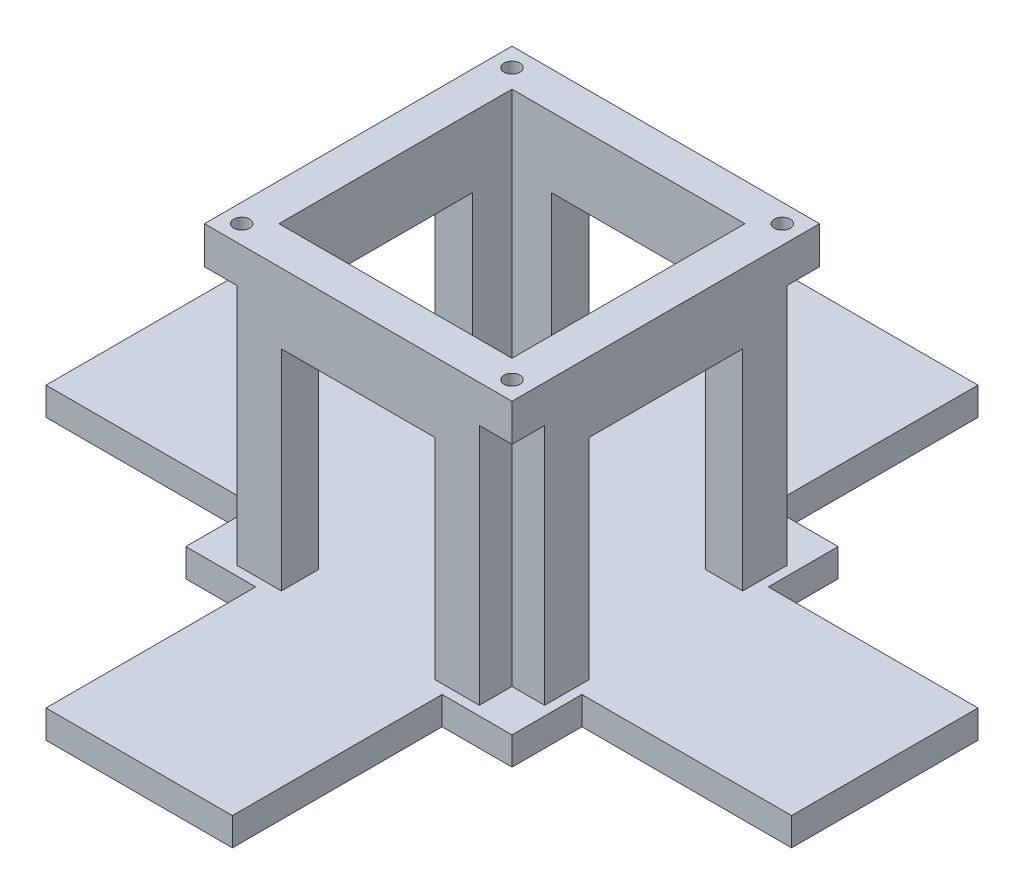
from build123d import *

# Parameters (mm, degrees)
BOSS_EXTRUDE1_DEPTH = 6
SKETCH2_W           = 66
SKETCH2_H           = 66
SKETCH2_R           = 1.705
SKETCH2_W_2         = 50
SKETCH2_H_2         = 50
BOSS_EXTRUDE2_DEPTH = 60
SKETCH4_W           = 7
SKETCH4_H           = 7
CUT_EXTRUDE2_DEPTH  = 52
SKETCH5_W           = 33
SKETCH5_H           = 8
SKETCH5_W_2         = 8
SKETCH5_H_2         = 33
CUT_EXTRUDE3_DEPTH  = 45


with BuildPart() as part:
    # Sketch1 → Boss-Extrude1 (new body)
    with BuildSketch(Plane(origin=(0, 0, 0), x_dir=(1, 0, 0), z_dir=(0, 1, 0))):
        Polygon((-20, 80), (20, 80), (20, 35), (35, 35), (35, 20), (80, 20), (80, -20), (35, -20), (35, -35), (20, -35), (20, -80), (-20, -80), (-20, -35), (-35, -35), (-35, -20), (-80, -20), (-80, 20), (-35, 20), (-35, 35), (-20, 35), align=None)
    extrude(amount=-BOSS_EXTRUDE1_DEPTH)

    # Sketch2 → Boss-Extrude2 (add)
    with BuildSketch(Plane(origin=(0, 0, 0), x_dir=(1, 0, 0), z_dir=(0, 1, 0))):
        Rectangle(SKETCH2_W, SKETCH2_H)
        with Locations(Location((29, 29, 0), (0, 0, 270))):
            Circle(SKETCH2_R, mode=Mode.SUBTRACT)
        with Locations(Location((-29, 29, 0), (0, 0, 270))):
            Circle(SKETCH2_R, mode=Mode.SUBTRACT)
        with Locations(Location((29, -29, 0), (0, 0, 270))):
            Circle(SKETCH2_R, mode=Mode.SUBTRACT)
        with Locations(Location((-29, -29, 0), (0, 0, 270))):
            Circle(SKETCH2_R, mode=Mode.SUBTRACT)
        Rectangle(SKETCH2_W_2, SKETCH2_H_2, mode=Mode.SUBTRACT)
    extrude(amount=BOSS_EXTRUDE2_DEPTH)

    # Sketch4 → Cut-Extrude2 (cut)
    with BuildSketch(Plane(origin=(0, 0, 0), x_dir=(1, 0, 0), z_dir=(0, 1, 0))):
        with Locations((-29.5, 29.5)):
            Rectangle(SKETCH4_W, SKETCH4_H)
        with Locations((29.5, 29.5)):
            Rectangle(SKETCH4_W, SKETCH4_H)
        with Locations((29.5, -29.5)):
            Rectangle(SKETCH4_W, SKETCH4_H)
        with Locations((-29.5, -29.5)):
            Rectangle(SKETCH4_W, SKETCH4_H)
    extrude(amount=CUT_EXTRUDE2_DEPTH, mode=Mode.SUBTRACT)

    # Sketch5 → Cut-Extrude3 (cut)
    with BuildSketch(Plane(origin=(0, 0, 0), x_dir=(1, 0, 0), z_dir=(0, 1, 0))):
        with Locations((0, 29)):
            Rectangle(SKETCH5_W, SKETCH5_H)
        with Locations((0, -29)):
            Rectangle(SKETCH5_W, SKETCH5_H)
        with Locations((29, 0)):
            Rectangle(SKETCH5_W_2, SKETCH5_H_2)
        with Locations((-29, 0)):
            Rectangle(SKETCH5_W_2, SKETCH5_H_2)
    extrude(amount=CUT_EXTRUDE3_DEPTH, mode=Mode.SUBTRACT)


solid = part.part
